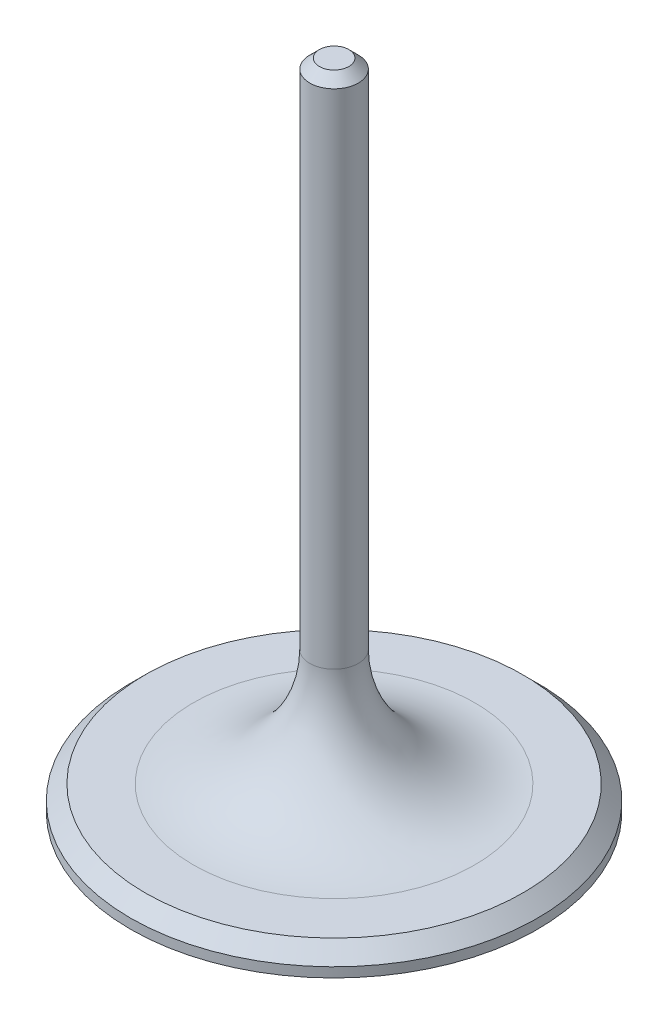
from build123d import *

# Parameters (mm, degrees)
SKETCH1_W     = 26.67
SKETCH1_H     = 1.27
CHAMFER1_SIZE = 1.25


with BuildPart() as part:
    # Sketch1 → Revolve1 (revolve)
    with BuildSketch(Plane.XY, mode=Mode.PRIVATE) as revolve1_sk:
        with Locations((13.335, 0.635)):
            Rectangle(SKETCH1_W, SKETCH1_H)
        with BuildLine():
            Line((3.18, 85.55), (0, 85.55))
            Line((0, 85.55), (0, 1.27))
            Line((0, 1.27), (26.67, 1.27))
            Line((26.67, 1.27), (24.76, 3.18))
            Line((24.76, 3.18), (18.43, 3.18))
            ThreePointArc((18.43, 3.18), (7.646621587, 7.646621587), (3.18, 18.43))
            Line((3.18, 18.43), (3.18, 85.55))
        make_face()
    revolve(revolve1_sk.sketch.rotate(Axis((0, 91.878860224, 0), (0, -1, 0)), 90), axis=Axis((0, 91.878860224, 0), (0, -1, 0)))

    # Chamfer1
    chamfer1_edges = [part.edges().sort_by_distance(p)[0] for p in [
        (0, 85.55, -3.18),
    ]]
    chamfer(chamfer1_edges, length=CHAMFER1_SIZE)


solid = part.part
